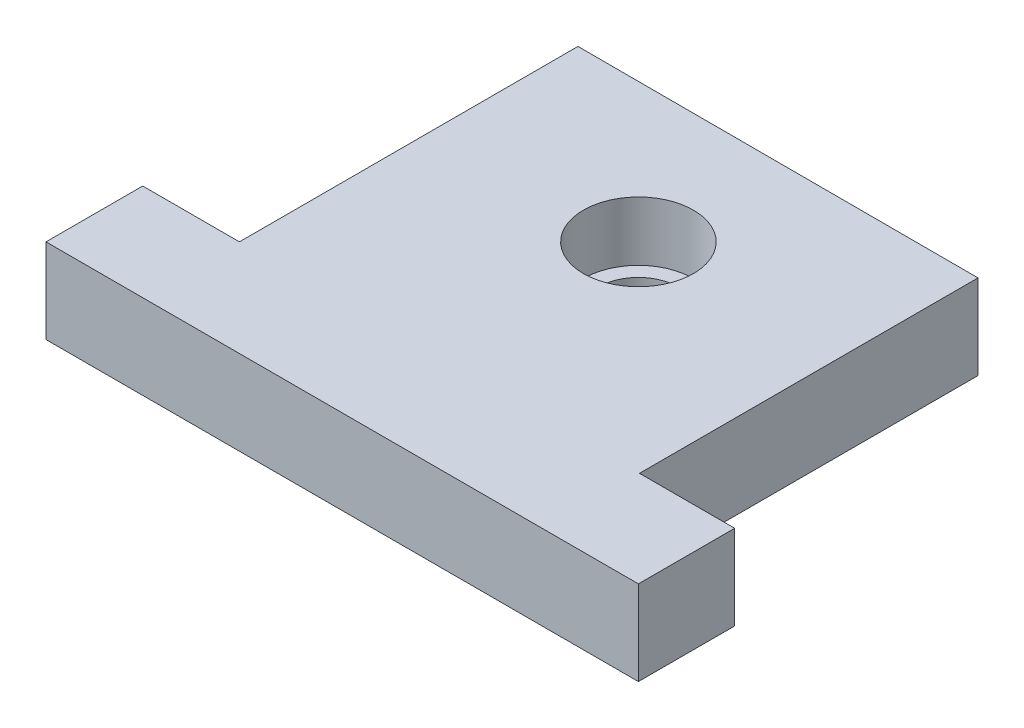
from build123d import *

# Parameters (mm, degrees)
BOSS_EXTRUDE1_DEPTH = 10
SKETCH2_R           = 6.5
CUT_EXTRUDE2_DEPTH  = 7
SKETCH5_R           = 4.75
CUT_EXTRUDE3_DEPTH  = 63.601101901


with BuildPart() as part:
    # Sketch1 → Boss-Extrude1 (new body)
    with BuildSketch(Plane(origin=(0, 0, 0), x_dir=(1, 0, 0), z_dir=(0, 1, 0))):
        Polygon((-23.571428571, 51.428571429), (23.752103043, 51.377146806), (23.752103043, 11.377146806), (35, 11.377146806), (35, 0), (-35, 0), (-35, 11.428571429), (-23.571428571, 11.428571429), align=None)
    extrude(amount=BOSS_EXTRUDE1_DEPTH)

    # Sketch2 → Cut-Extrude2 (cut)
    with BuildSketch(Plane(origin=(0, 10, 0), x_dir=(1, 0, 0), z_dir=(0, 1, 0))):
        with Locations(Location((0, 35, 0), (0, 0, 270))):
            Circle(SKETCH2_R)
    extrude(amount=-CUT_EXTRUDE2_DEPTH, mode=Mode.SUBTRACT)

    # Sketch5 → Cut-Extrude3 (cut, through all)
    with BuildSketch(Plane(origin=(0, 3, 0), x_dir=(1, 0, 0), z_dir=(0, 1, 0))):
        with Locations(Location((0, 35, 0), (0, 0, 270))):
            Circle(SKETCH5_R)
    extrude(amount=-CUT_EXTRUDE3_DEPTH, mode=Mode.SUBTRACT)


solid = part.part
